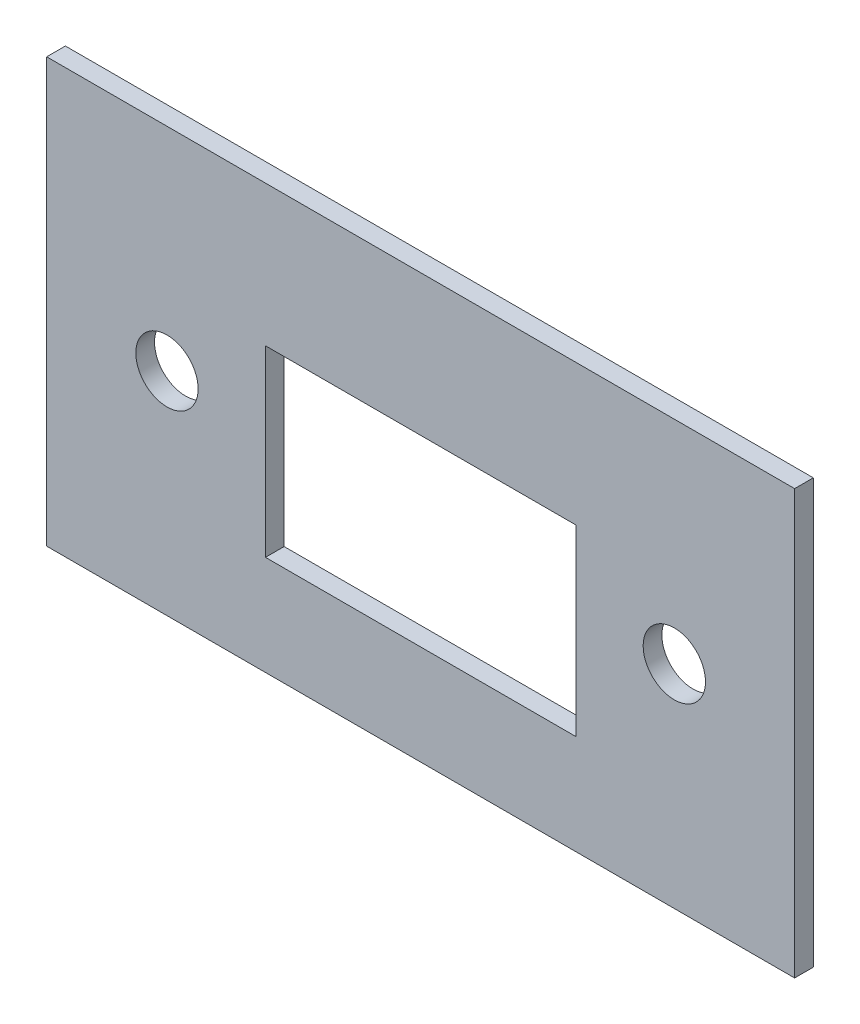
from build123d import *

# Parameters (mm, degrees)
ESQUISSE2_W             = 55.8
ESQUISSE2_H             = 29.8
ESQUISSE2_W_2           = 52.8
ESQUISSE2_H_2           = 26.8
BOSS_EXTRU_1_DEPTH      = 2
ESQUISSE3_W             = 60
ESQUISSE3_H             = 34
BOSS_EXTRU_2_DEPTH      = 1.5
ESQUISSE4_W             = 24.9
ESQUISSE4_H             = 14.7
ENL_V_MAT_EXTRU_1_DEPTH = 1.5
ESQUISSE5_R             = 2.5
ENL_V_MAT_EXTRU_2_DEPTH = 1.5


with BuildPart() as part:
    # Esquisse2 → Boss.-Extru.1 (new body)
    with BuildSketch(Plane.XY):
        with Locations((0, 14.9)):
            Rectangle(ESQUISSE2_W, ESQUISSE2_H)
        with Locations((0, 14.9)):
            Rectangle(ESQUISSE2_W_2, ESQUISSE2_H_2, mode=Mode.SUBTRACT)
    extrude(amount=-BOSS_EXTRU_1_DEPTH)

    # Esquisse3 → Boss.-Extru.2 (add)
    with BuildSketch(Plane.XY):
        with Locations((0, 14.9)):
            Rectangle(ESQUISSE3_W, ESQUISSE3_H)
    extrude(amount=BOSS_EXTRU_2_DEPTH)

    # Esquisse4 → Enlèv. mat.-Extru.1 (cut)
    with BuildSketch(Plane.XY.offset(1.5)):
        with Locations((0, 13.25)):
            Rectangle(ESQUISSE4_W, ESQUISSE4_H)
    extrude(amount=-ENL_V_MAT_EXTRU_1_DEPTH, mode=Mode.SUBTRACT)

    # Esquisse5 → Enlèv. mat.-Extru.2 (cut)
    with BuildSketch(Plane(origin=(0, 0, 0), x_dir=(-1, 0, 0), z_dir=(0, 0, -1))):
        with Locations((20.35, 14.9)):
            Circle(ESQUISSE5_R)
        with Locations((-20.35, 14.9)):
            Circle(ESQUISSE5_R)
    extrude(amount=-ENL_V_MAT_EXTRU_2_DEPTH, mode=Mode.SUBTRACT)


solid = part.part
